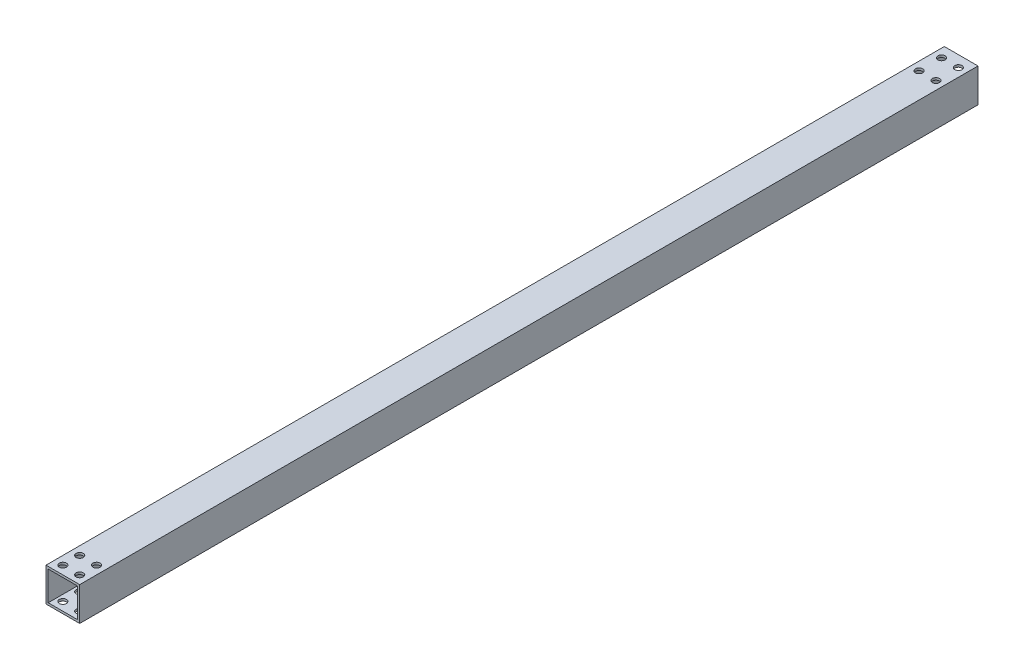
from build123d import *

# Parameters (mm, degrees)
SKETCH_1_W          = 15
SKETCH_1_H          = 15
SKETCH_1_W_2        = 13
SKETCH_1_H_2        = 13
EXTRUDE_1_DEPTH     = 400
SKETCH_2_R          = 1.6
CUT_EXTRUDE_1_DEPTH = 401.562105047


with BuildPart() as part:
    # 草图1 → 拉伸-薄壁1 (new body)
    with BuildSketch(Plane.XY):
        with Locations((7.5, -7.5)):
            Rectangle(SKETCH_1_W, SKETCH_1_H)
        with Locations((7.5, -7.5)):
            Rectangle(SKETCH_1_W_2, SKETCH_1_H_2, mode=Mode.SUBTRACT)
    extrude(amount=EXTRUDE_1_DEPTH)

    # 草图2 → 切除-拉伸1 (cut, through all)
    with BuildSketch(Plane(origin=(0, 0, 0), x_dir=(1, 0, 0), z_dir=(0, 1, 0))):
        with Locations(Location((3.75, -5, 0), (0, 0, 270))):
            Circle(SKETCH_2_R)
        with Locations(Location((11.25, -5, 0), (0, 0, 90))):
            Circle(SKETCH_2_R)
        with Locations(Location((11.25, -15, 0), (0, 0, 270))):
            Circle(SKETCH_2_R)
        with Locations(Location((3.75, -15, 0), (0, 0, 90))):
            Circle(SKETCH_2_R)
        with Locations(Location((3.75, -396.25, 0), (0, 0, 270))):
            Circle(SKETCH_2_R)
        with Locations(Location((11.25, -396.25, 0), (0, 0, 90))):
            Circle(SKETCH_2_R)
        with Locations(Location((11.25, -388.75, 0), (0, 0, 270))):
            Circle(SKETCH_2_R)
        with Locations(Location((3.75, -388.75, 0), (0, 0, 90))):
            Circle(SKETCH_2_R)
    extrude(amount=-CUT_EXTRUDE_1_DEPTH, mode=Mode.SUBTRACT)


solid = part.part
